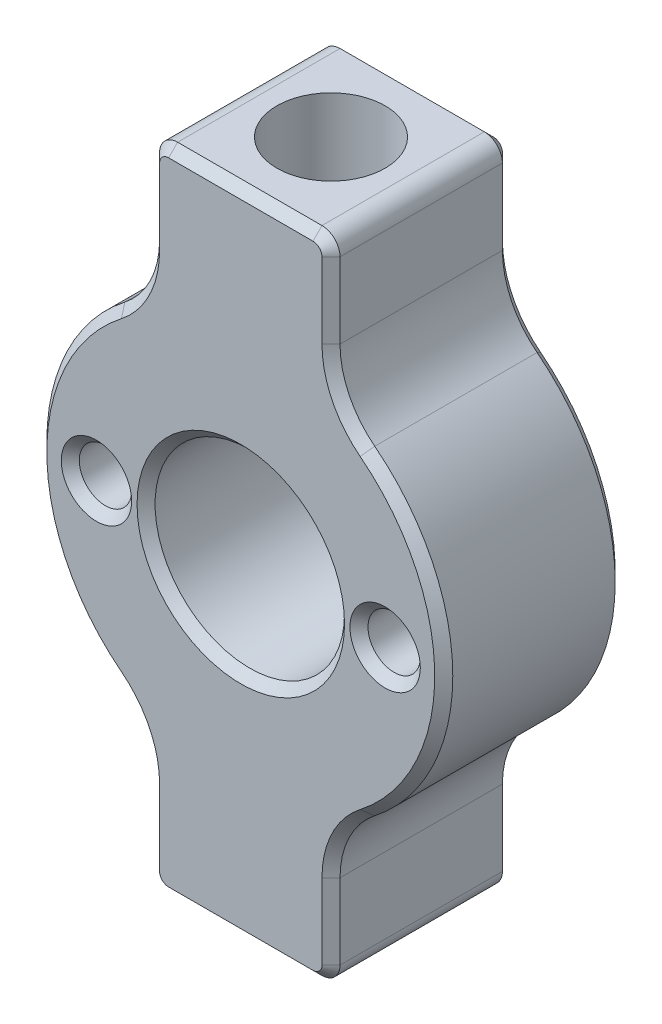
from build123d import *

# Parameters (mm, degrees)
SKIZZE1_R                       = 11.25
SKIZZE1_R_2                     = 5.25
AUFSATZ_LINEAR_AUSTRAGEN1_DEPTH = 10
AUFSATZ_LINEAR_START            = 6
SKIZZE2_W                       = 10
SKIZZE2_H                       = 10
AUFSATZ_LINEAR_AUSTRAGEN2_DEPTH = 12
SKIZZE3_R                       = 3
SCHNITT_LINEAR_AUSTRAGEN1_DEPTH = 10
SKIZZE4_R                       = 1.45
SCHNITT_LINEAR_AUSTRAGEN2_DEPTH = 8
VERRUNDUNG2_R                   = 5
VERRUNDUNG1_R                   = 1
FASE1_SIZE                      = 0.5


with BuildPart() as part:
    # Skizze1 → Aufsatz-Linear austragen1 (new body)
    with BuildSketch(Plane.XY):
        Circle(SKIZZE1_R)
        Circle(SKIZZE1_R_2, mode=Mode.SUBTRACT)
    extrude(amount=AUFSATZ_LINEAR_AUSTRAGEN1_DEPTH)

    # Skizze2 → Aufsatz-Linear austragen2 (add)
    with BuildSketch(Plane(origin=(0, 0, 0), x_dir=(1, 0, 0), z_dir=(0, 1, 0)).offset(AUFSATZ_LINEAR_START)):
        with Locations((0, -5)):
            Rectangle(SKIZZE2_W, SKIZZE2_H)
    aufsatz_linear_austragen2 = extrude(amount=AUFSATZ_LINEAR_AUSTRAGEN2_DEPTH)

    # Skizze3 → Schnitt-Linear austragen1 (cut)
    with BuildSketch(Plane(origin=(0, 18, 0), x_dir=(1, 0, 0), z_dir=(0, 1, 0))):
        with Locations(Location((0, -5, 0), (0, 0, 270))):
            Circle(SKIZZE3_R)
    schnitt_linear_austragen1 = extrude(amount=-SCHNITT_LINEAR_AUSTRAGEN1_DEPTH, mode=Mode.SUBTRACT)

    # Spiegeln1: Aufsatz-Linear austragen2, Schnitt-Linear austragen1 across plane
    add(aufsatz_linear_austragen2.mirror(Plane.ZX))
    add(schnitt_linear_austragen1.mirror(Plane.ZX), mode=Mode.SUBTRACT)

    # Skizze4 → Schnitt-Linear austragen2 (cut)
    with BuildSketch(Plane.XY.offset(10)):
        with Locations((8, 0)):
            Circle(SKIZZE4_R)
        with Locations(Location((-8, 0, 0), (0, 0, 180))):
            Circle(SKIZZE4_R)
    extrude(amount=-SCHNITT_LINEAR_AUSTRAGEN2_DEPTH, mode=Mode.SUBTRACT)

    # Verrundung2
    verrundung2_edges = [part.edges().sort_by_distance(p)[0] for p in [
        (-5, 10.077822185, 5),
        (5, 10.077822185, 5),
        (5, -10.077822185, 5),
        (-5, -10.077822185, 5),
    ]]
    fillet(verrundung2_edges, radius=VERRUNDUNG2_R)

    # Verrundung1
    verrundung1_edges = [part.edges().sort_by_distance(p)[0] for p in [
        (5, 18, 5),
        (-5, 18, 5),
        (5, -18, 5),
        (-5, -18, 5),
    ]]
    fillet(verrundung1_edges, radius=VERRUNDUNG1_R)

    # Fase1
    fase1_edges = [part.edges().sort_by_distance(p)[0] for p in [
        (-5, 14.904344229, 10),
        (-5, -14.904344229, 10),
        (0, -18, 10),
        (5, -14.904344229, 10),
        (5, 14.904344229, 10),
        (-4.707106781, -17.707106781, 10),
        (4.707106781, -17.707106781, 10),
        (4.707106781, 17.707106781, 10),
        (-4.707106781, 17.707106781, 10),
        (-5, 14.904344229, 0),
        (5, -14.904344229, 0),
        (0, -18, 0),
        (-5, -14.904344229, 0),
        (5, 14.904344229, 0),
        (-4.707106781, -17.707106781, 0),
        (4.707106781, -17.707106781, 0),
        (4.707106781, 17.707106781, 0),
        (-4.707106781, 17.707106781, 0),
        (-5.25, 0, 0),
        (-5.25, 0, 10),
        (6.55, 0, 10),
        (-6.55, 0, 10),
        (-11.25, 0, 0),
        (-11.25, 0, 10),
        (11.25, 0, 10),
        (11.25, 0, 0),
        (-5.506414829, -10.616043409, 10),
        (-5.506414829, -10.616043409, 0),
        (-5.506414829, 10.616043409, 10),
        (-5.506414829, 10.616043409, 0),
        (5.506414829, 10.616043409, 0),
        (5.506414829, 10.616043409, 10),
        (5.506414829, -10.616043409, 0),
        (5.506414829, -10.616043409, 10),
        (0, 18, 0),
        (0, 18, 10),
    ]]
    chamfer(fase1_edges, length=FASE1_SIZE)


solid = part.part
